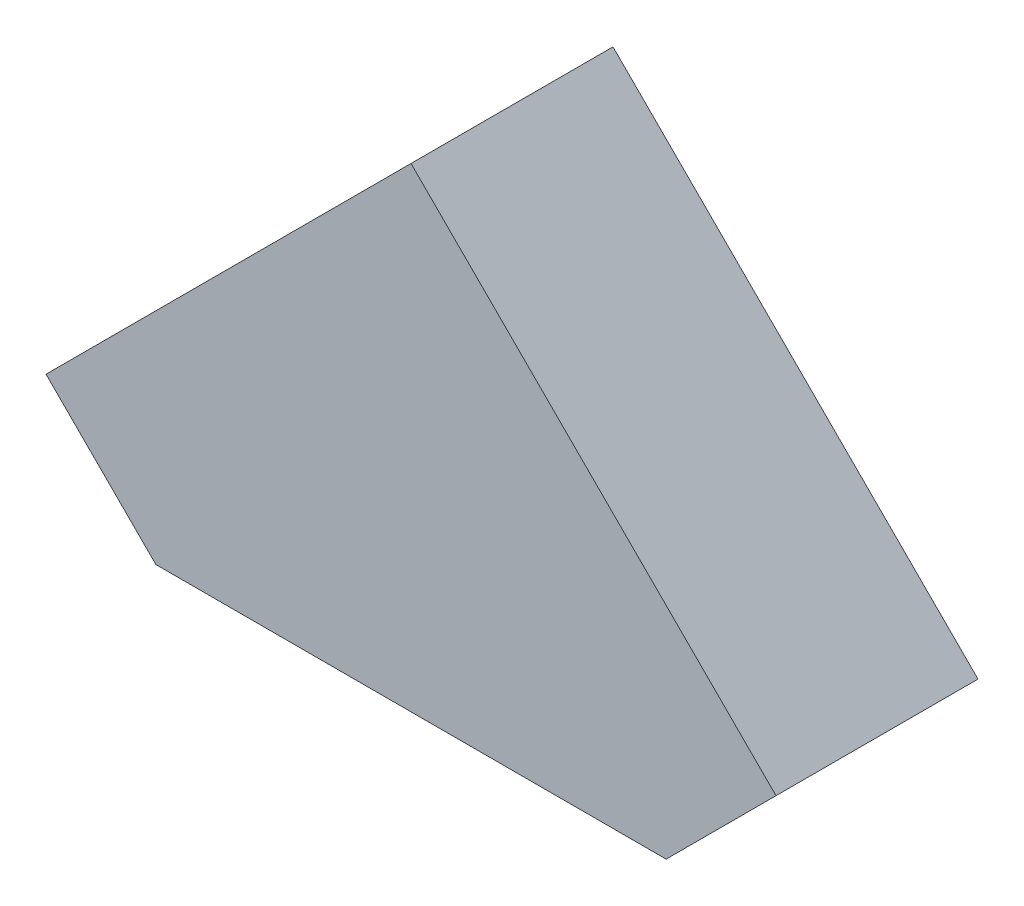
from build123d import *

# Parameters (mm, degrees)
EXTRUDE_1_DEPTH          = 12.75
EXTRUDE_1_DEPTH_BACK     = 12.75
EXTRUDE_1_2_DEPTH        = 1.2
EXTRUDE_2_DEPTH          = 1.2
SKETCH_4_W               = 23.6
SKETCH_4_H               = 23.6
CUT_EXTRUDE_1_DEPTH      = 1.5
CUT_EXTRUDE_2_DEPTH      = 35.680906203
CUT_EXTRUDE_2_DEPTH_BACK = 35.680906203
SKETCH_5_W               = 13.95
SKETCH_5_H               = 32.801494515


with BuildPart() as part:
    # Эскиз1 → Extrude 1 (new, two sides: drawn at the far end of the back side and taken through both)
    with BuildSketch(Plane.XY.offset(-EXTRUDE_1_DEPTH_BACK)):
        Polygon((-17.621320344, -13.5), (17.621320344, -13.5), (25.211407429, -5.909912914), (0, 19.301494515), (-25.211407429, -5.909912914), align=None)
        Polygon((-17, -12), (17, -12), (23.090087086, -5.909912914), (0, 17.180174171), (-23.090087086, -5.909912914), align=None, mode=Mode.SUBTRACT)
    extrude(amount=EXTRUDE_1_DEPTH + EXTRUDE_1_DEPTH_BACK)

    # Эскиз2 → Extrude 1 2 (add)
    with BuildSketch(Plane.XY.offset(12.75)):
        Polygon((25.211407429, -5.909912914), (0, 19.301494515), (-25.211407429, -5.909912914), (-17.621320344, -13.5), (17.621320344, -13.5), align=None)
    extrude(amount=EXTRUDE_1_2_DEPTH)

    # Эскиз3 → Бобышка-Вытянуть2 (add)
    with BuildSketch(Plane(origin=(0, 0, -12.75), x_dir=(-1, 0, 0), z_dir=(0, 0, -1))):
        Polygon((0, 19.301494515), (25.211407429, -5.909912914), (17.621320344, -13.5), (-17.621320344, -13.5), (-25.211407429, -5.909912914), align=None)
    extrude(amount=EXTRUDE_2_DEPTH)

    # Эскиз4 → Вырез-Вытянуть1 (cut)
    with BuildSketch(Plane.XZ.offset(13.5)):
        Rectangle(SKETCH_4_W, SKETCH_4_H)
    extrude(amount=-CUT_EXTRUDE_1_DEPTH, mode=Mode.SUBTRACT)

    # Эскиз5 → Вырез-Вытянуть2 (cut, two sides: drawn at the far end of the back side and taken through both)
    with BuildSketch(Plane(origin=(0, 0, 0), x_dir=(0, 0, -1), z_dir=(1, 0, 0)).offset(-CUT_EXTRUDE_2_DEPTH_BACK)):
        with Locations((6.975, 2.900747258)):
            Rectangle(SKETCH_5_W, SKETCH_5_H)
    extrude(amount=CUT_EXTRUDE_2_DEPTH + CUT_EXTRUDE_2_DEPTH_BACK, mode=Mode.SUBTRACT)


solid = part.part
